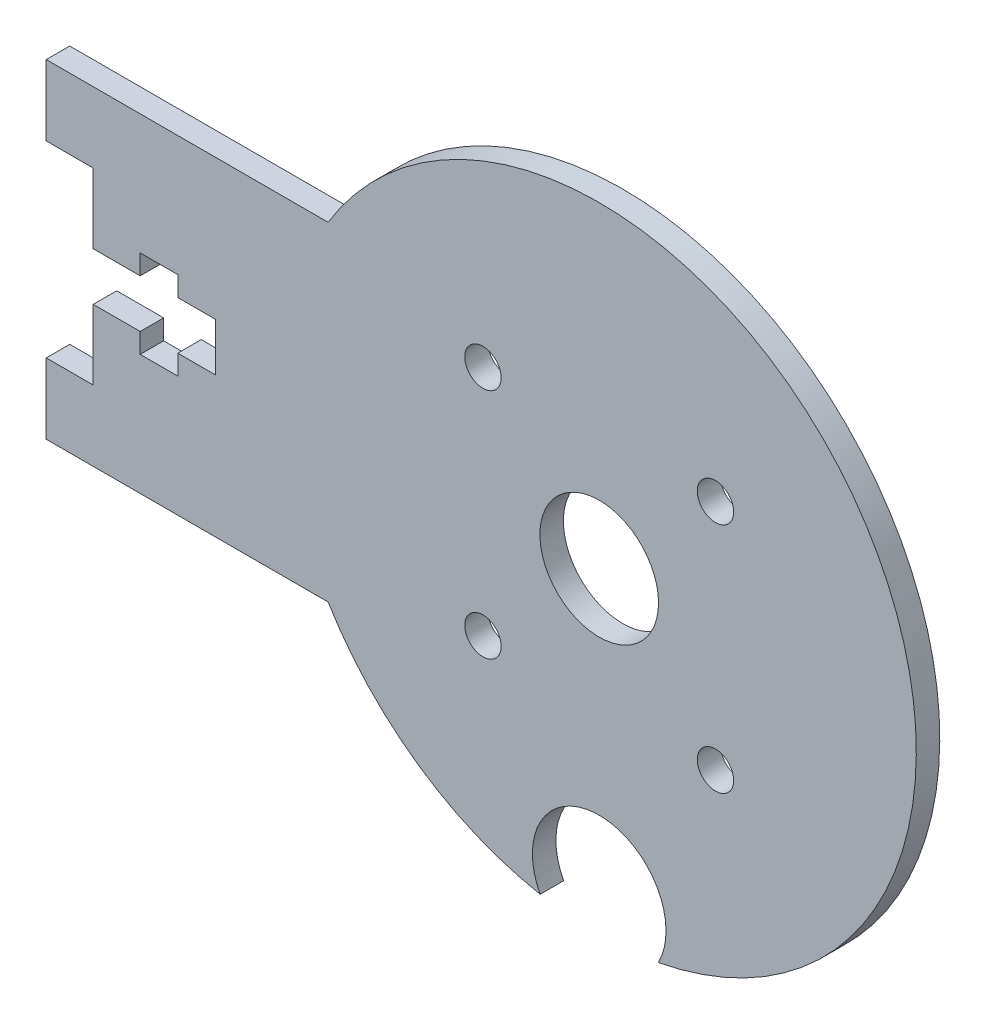
from build123d import *

# Parameters (mm, degrees)
SKETCH_1_R      = 5.05
SKETCH_1_R_2    = 1.55
EXTRUDE_1_DEPTH = 2


with BuildPart() as part:
    # 草图1 → 凸台-拉伸1 (new body)
    with BuildSketch(Plane.XY):
        with BuildLine():
            Line((-23.086792761, -14), (-43.086792761, -14))
            Line((-43.086792761, -14), (-47.086792761, -14))
            Line((-47.086792761, -14), (-47.086792761, -8))
            Line((-47.086792761, -8), (-43.086792761, -8))
            Line((-43.086792761, -8), (-43.086792761, -2.05))
            Line((-43.086792761, -2.05), (-39.086792761, -2.05))
            Line((-39.086792761, -2.05), (-39.086792761, -3.741370628))
            Line((-39.086792761, -3.741370628), (-35.886792761, -3.741370628))
            Line((-35.886792761, -3.741370628), (-35.886792761, -2.05))
            Line((-35.886792761, -2.05), (-32.686792761, -2.05))
            Line((-32.686792761, -2.05), (-32.686792761, 2.05))
            Line((-32.686792761, 2.05), (-35.886792761, 2.05))
            Line((-35.886792761, 2.05), (-35.886792761, 3.741370628))
            Line((-35.886792761, 3.741370628), (-39.086792761, 3.741370628))
            Line((-39.086792761, 3.741370628), (-39.086792761, 2.05))
            Line((-39.086792761, 2.05), (-43.086792761, 2.05))
            Line((-43.086792761, 2.05), (-43.086792761, 8))
            Line((-43.086792761, 8), (-47.086792761, 8))
            Line((-47.086792761, 8), (-47.086792761, 14))
            Line((-47.086792761, 14), (-43.086792761, 14))
            Line((-43.086792761, 14), (-23.086792761, 14))
            ThreePointArc((-23.086792761, 14), (22.184698295, 15.389579642), (5.027449154, -26.527810973))
            ThreePointArc((5.027449154, -26.527810973), (0, -18.175825951), (-5.027449154, -26.527810973))
            ThreePointArc((-5.027449154, -26.527810973), (-15.389579642, -22.184698295), (-23.086792761, -14))
        make_face()
        Circle(SKETCH_1_R, mode=Mode.SUBTRACT)
        with Locations((-9.899494937, -9.899494937)):
            Circle(SKETCH_1_R_2, mode=Mode.SUBTRACT)
        with Locations((-9.899494937, 9.899494937)):
            Circle(SKETCH_1_R_2, mode=Mode.SUBTRACT)
        with Locations((9.899494937, 9.899494937)):
            Circle(SKETCH_1_R_2, mode=Mode.SUBTRACT)
        with Locations((9.899494937, -9.899494937)):
            Circle(SKETCH_1_R_2, mode=Mode.SUBTRACT)
    extrude(amount=EXTRUDE_1_DEPTH)


solid = part.part
